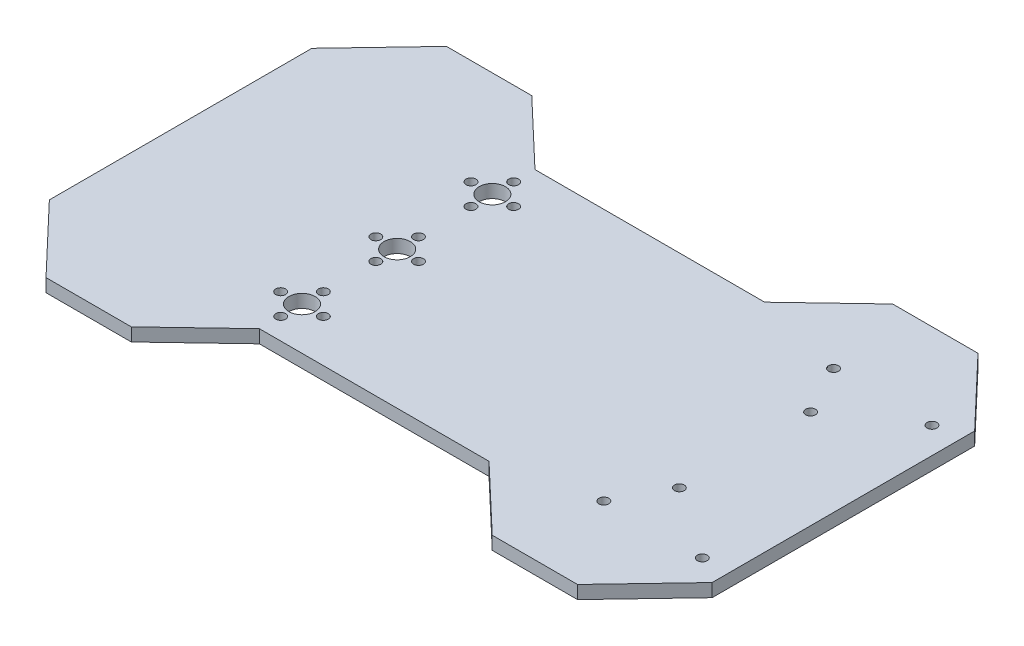
from build123d import *

# Parameters (mm, degrees)
BOSS_EXTRUDE1_DEPTH = 4
SKETCH3_R           = 4
SKETCH3_R_2         = 1.5
CUT_EXTRUDE1_DEPTH  = 119.072218241
SKETCH5_R           = 1.5
CUT_EXTRUDE2_DEPTH  = 119.072218241
SKETCH6_R           = 1.5
CUT_EXTRUDE3_DEPTH  = 119.072218241


with BuildPart() as part:
    # Sketch1 → Boss-Extrude1 (new body)
    with BuildSketch(Plane(origin=(0, 0, 0), x_dir=(1, 0, 0), z_dir=(0, 1, 0))):
        Polygon((-55, 61.024984395), (-35, 42), (35, 42), (55, 61.024984395), (81, 61.024984395), (101, 40), (101, -40), (81, -61.024984395), (55, -61.024984395), (35, -42), (-35, -42), (-55, -61.024984395), (-81, -61.024984395), (-101, -40), (-101, 40), (-81, 61.024984395), align=None)
    extrude(amount=BOSS_EXTRUDE1_DEPTH)

    # Sketch3 → Cut-Extrude1 (cut, through all)
    with BuildSketch(Plane(origin=(0, 4, 0), x_dir=(1, 0, 0), z_dir=(0, 1, 0))):
        with Locations(Location((-35, -29, 0), (0, 0, 270))):
            Circle(SKETCH3_R)
        with Locations(Location((-28.5, -29, 0), (0, 0, 270))):
            Circle(SKETCH3_R_2)
        with Locations(Location((-41.5, -29, 0), (0, 0, 270))):
            Circle(SKETCH3_R_2)
        with Locations(Location((-35, -22.5, 0), (0, 0, 270))):
            Circle(SKETCH3_R_2)
        with Locations(Location((-35, -35.5, 0), (0, 0, 270))):
            Circle(SKETCH3_R_2)
        with Locations(Location((-35, 35.5, 0), (0, 0, 90))):
            Circle(SKETCH3_R_2)
        with Locations(Location((-35, 22.5, 0), (0, 0, 90))):
            Circle(SKETCH3_R_2)
        with Locations(Location((-41.5, 29, 0), (0, 0, 90))):
            Circle(SKETCH3_R_2)
        with Locations(Location((-28.5, 29, 0), (0, 0, 90))):
            Circle(SKETCH3_R_2)
        with Locations(Location((-35, 29, 0), (0, 0, 90))):
            Circle(SKETCH3_R)
        with Locations(Location((-35, 0, 0), (0, 0, 270))):
            Circle(SKETCH3_R)
        with Locations(Location((-35, 6.5, 0), (0, 0, 270))):
            Circle(SKETCH3_R_2)
        with Locations(Location((-28.5, 0, 0), (0, 0, 270))):
            Circle(SKETCH3_R_2)
        with Locations(Location((-41.5, 0, 0), (0, 0, 270))):
            Circle(SKETCH3_R_2)
        with Locations(Location((-35, -6.5, 0), (0, 0, 270))):
            Circle(SKETCH3_R_2)
    extrude(amount=-CUT_EXTRUDE1_DEPTH, mode=Mode.SUBTRACT)

    # Sketch5 → Cut-Extrude2 (cut, through all)
    with BuildSketch(Plane(origin=(0, 4, 0), x_dir=(1, 0, 0), z_dir=(0, 1, 0))):
        with Locations(Location((93, 35, 0), (0, 0, 270))):
            Circle(SKETCH5_R)
        with Locations(Location((63, 35, 0), (0, 0, 270))):
            Circle(SKETCH5_R)
        with Locations(Location((63, -35, 0), (0, 0, 90))):
            Circle(SKETCH5_R)
        with Locations(Location((93, -35, 0), (0, 0, 90))):
            Circle(SKETCH5_R)
    extrude(amount=-CUT_EXTRUDE2_DEPTH, mode=Mode.SUBTRACT)

    # Sketch6 → Cut-Extrude3 (cut, through all)
    with BuildSketch(Plane.XZ):
        with Locations(Location((71, 20, 0), (0, 0, 270))):
            Circle(SKETCH6_R)
        with Locations(Location((71, -20, 0), (0, 0, 270))):
            Circle(SKETCH6_R)
    extrude(amount=-CUT_EXTRUDE3_DEPTH, mode=Mode.SUBTRACT)


solid = part.part
